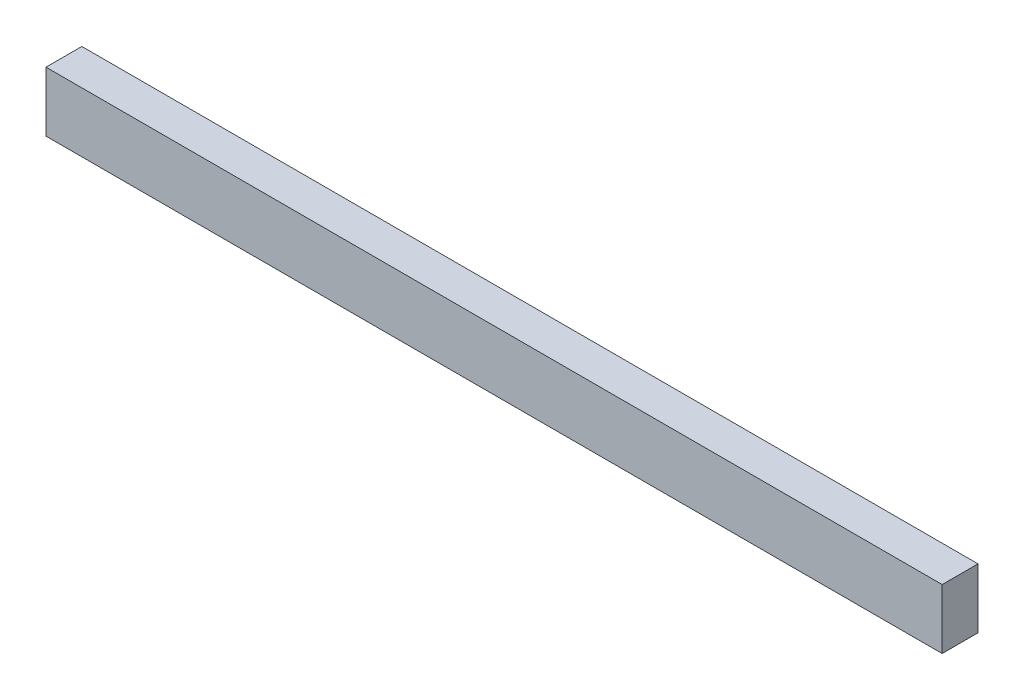
from build123d import *

# Parameters (mm, degrees)
SKETCH1_W           = 150
SKETCH1_H           = 10
BOSS_EXTRUDE1_DEPTH = 6


with BuildPart() as part:
    # Sketch1 → Boss-Extrude1 (new body)
    with BuildSketch(Plane.XY):
        with Locations((75, 5)):
            Rectangle(SKETCH1_W, SKETCH1_H)
    extrude(amount=BOSS_EXTRUDE1_DEPTH)


solid = part.part
